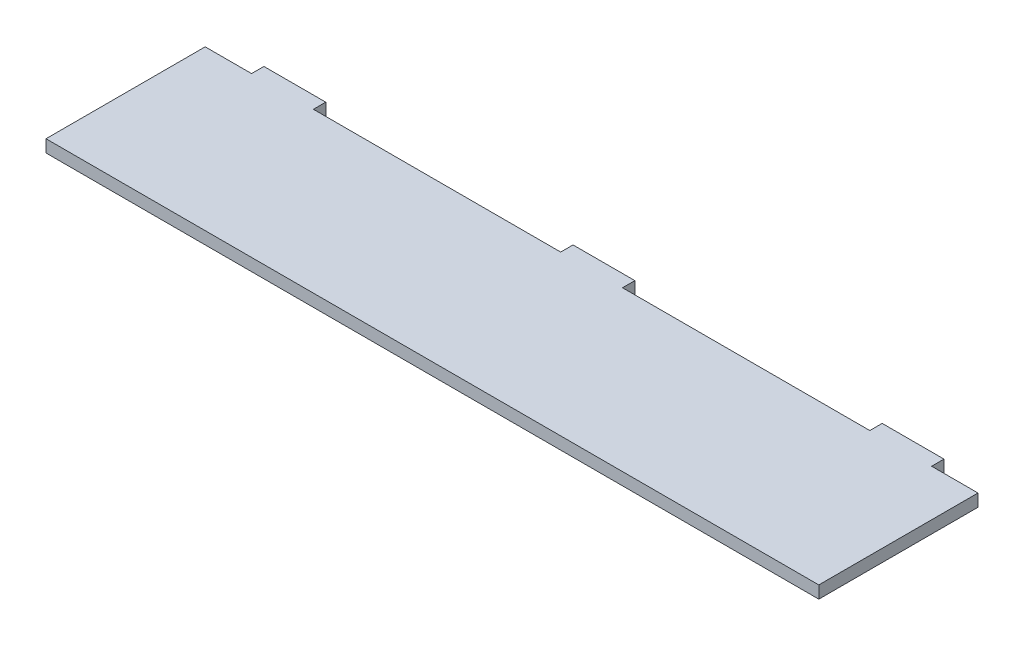
from build123d import *

# Parameters (mm, degrees)
BOSS_EXTRUDE1_DEPTH = 4


with BuildPart() as part:
    # Sketch1 → Boss-Extrude1 (new body)
    with BuildSketch(Plane(origin=(0, 0, 0), x_dir=(1, 0, 0), z_dir=(0, 1, 0))):
        Polygon((-110, 27.75), (-90, 27.75), (-90, 23.75), (-10, 23.75), (-10, 27.75), (10, 27.75), (10, 23.75), (90, 23.75), (90, 27.75), (110, 27.75), (110, 23.75), (125, 23.75), (125, -27.75), (-125, -27.75), (-125, 23.75), (-110, 23.75), align=None)
    extrude(amount=BOSS_EXTRUDE1_DEPTH)


solid = part.part
